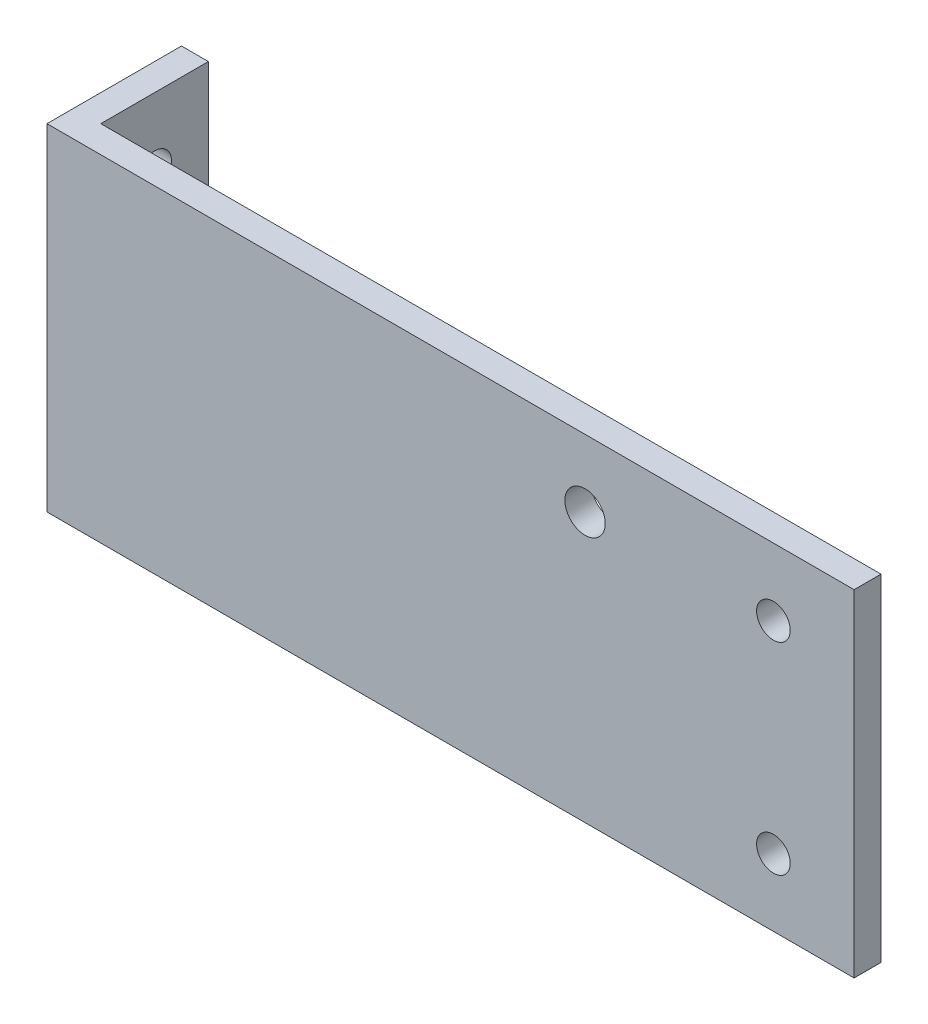
from build123d import *

# Parameters (mm, degrees)
EXTRUDE_1_DEPTH     = 50
SKETCH_2_R          = 2.5
CUT_EXTRUDE_1_DEPTH = 10
SKETCH_3_R          = 2.5
SKETCH_3_R_2        = 3
CUT_EXTRUDE_2_DEPTH = 10


with BuildPart() as part:
    # Эскиз1 → Бобышка-Вытянуть1 (new body)
    with BuildSketch(Plane(origin=(0, 0, 0), x_dir=(1, 0, 0), z_dir=(0, 1, 0))):
        Polygon((0, 0), (120, 0), (120, 4), (4, 4), (4, 20), (0, 20), (0, 4), align=None)
    extrude(amount=EXTRUDE_1_DEPTH)

    # Эскиз2 → Вырез-Вытянуть1 (cut)
    with BuildSketch(Plane.ZY):
        with Locations((-12, 40)):
            Circle(SKETCH_2_R)
        with Locations((-12, 10)):
            Circle(SKETCH_2_R)
    extrude(amount=-CUT_EXTRUDE_1_DEPTH, mode=Mode.SUBTRACT)

    # Эскиз3 → Вырез-Вытянуть2 (cut)
    with BuildSketch(Plane.XY):
        with Locations((108, 40)):
            Circle(SKETCH_3_R)
        with Locations((108, 10)):
            Circle(SKETCH_3_R)
        with Locations((80, 40)):
            Circle(SKETCH_3_R_2)
    extrude(amount=-CUT_EXTRUDE_2_DEPTH, mode=Mode.SUBTRACT)


solid = part.part
